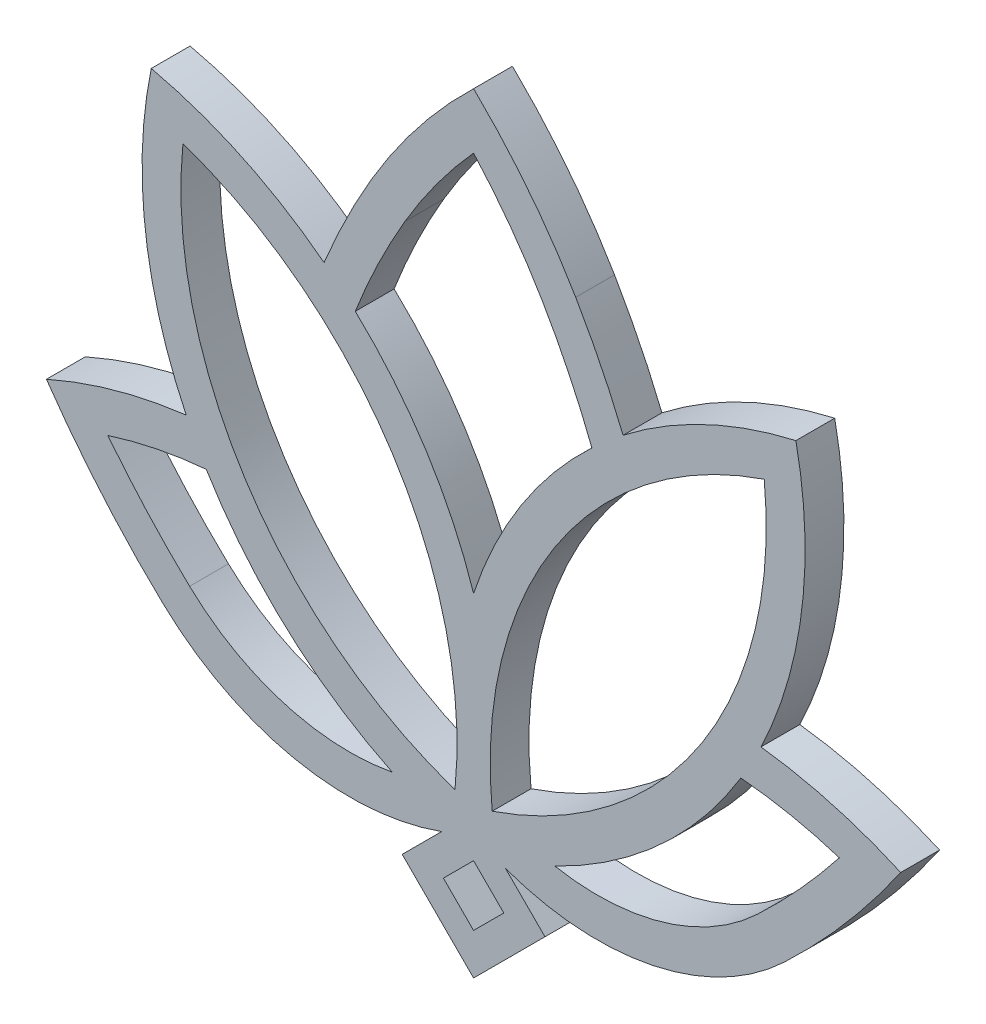
from build123d import *

# Parameters (mm, degrees)
BOSS_EXTRUDE1_DEPTH = 1


with BuildPart() as part:
    # Sketch1 → Boss-Extrude1 (new body)
    with BuildSketch(Plane.XY):
        with BuildLine():
            Line((0, 0), (1.838477631, 1.838477631))
            Line((1.838477631, 1.838477631), (0.823678808, 2.853276454))
            ThreePointArc((0.823678808, 2.853276454), (4.623918861, 2.588642918), (8, 4.353276454))
            ThreePointArc((8, 4.353276454), (9.591924549, 6.024483983), (11, 7.853276454))
            ThreePointArc((11, 7.853276454), (9.237519313, 8.488345979), (7.4, 8.853276454))
            ThreePointArc((7.4, 8.853276454), (8.450856423, 12.419917717), (8.3, 16.135085474))
            ThreePointArc((8.3, 16.135085474), (5.960145608, 15.324834522), (3.85, 14.029183838))
            ThreePointArc((3.85, 14.029183838), (3.284007759, 15.28410345), (2.63, 16.495484604))
            ThreePointArc((2.63, 16.495484604), (1.429185762, 18.254368816), (0, 19.833310412))
            ThreePointArc((0, 19.833310412), (-1.429185762, 18.254368816), (-2.63, 16.495484604))
            ThreePointArc((-2.63, 16.495484604), (-3.284007759, 15.28410345), (-3.85, 14.029183838))
            ThreePointArc((-3.85, 14.029183838), (-5.960145608, 15.324834522), (-8.3, 16.135085474))
            ThreePointArc((-8.3, 16.135085474), (-8.450856423, 12.419917717), (-7.4, 8.853276454))
            ThreePointArc((-7.4, 8.853276454), (-9.237519313, 8.488345979), (-11, 7.853276454))
            ThreePointArc((-11, 7.853276454), (-9.591924549, 6.024483983), (-8, 4.353276454))
            ThreePointArc((-8, 4.353276454), (-4.623918861, 2.588642918), (-0.823678808, 2.853276454))
            Line((-0.823678808, 2.853276454), (-1.838477631, 1.838477631))
            Line((-1.838477631, 1.838477631), (0, 0))
        make_face()
        Polygon((0, 1.060660172), (0.777817459, 1.838477631), (0, 2.61629509), (-0.777817459, 1.838477631), align=None, mode=Mode.SUBTRACT)
        with BuildLine():
            ThreePointArc((1.767555689, 15.989332639), (2.460089794, 14.692656758), (3.046312622, 13.344578636))
            ThreePointArc((3.046312622, 13.344578636), (1.223262024, 11.152840308), (0, 8.577794598))
            ThreePointArc((0, 8.577794598), (-1.223262024, 11.152840308), (-3.046312622, 13.344578636))
            ThreePointArc((-3.046312622, 13.344578636), (-2.460089794, 14.692656758), (-1.767555689, 15.989332639))
            ThreePointArc((-1.767555689, 15.989332639), (-0.945525016, 17.238680092), (0, 18.397380194))
            ThreePointArc((0, 18.397380194), (0.945525016, 17.238680092), (1.767555689, 15.989332639))
        make_face(mode=Mode.SUBTRACT)
        with BuildLine():
            ThreePointArc((7.484522548, 14.86555012), (2.078927518, 10.634692843), (0.478972095, 3.959308692))
            ThreePointArc((0.478972095, 3.959308692), (5.884567125, 8.190165969), (7.484522548, 14.86555012))
        make_face(mode=Mode.SUBTRACT)
        with BuildLine():
            ThreePointArc((2.091646058, 3.542273843), (4.886787797, 3.684978553), (7.313103604, 5.080031806))
            ThreePointArc((7.313103604, 5.080031806), (8.408951023, 6.195914234), (9.418710619, 7.390259542))
            ThreePointArc((9.418710619, 7.390259542), (8.165419306, 7.717459739), (6.883314947, 7.901870952))
            ThreePointArc((6.883314947, 7.901870952), (4.803155716, 5.375111185), (2.091646058, 3.542273843))
        make_face(mode=Mode.SUBTRACT)
        with BuildLine():
            ThreePointArc((-6.883314947, 7.901870952), (-8.165419306, 7.717459739), (-9.418710619, 7.390259542))
            ThreePointArc((-9.418710619, 7.390259542), (-8.408951023, 6.195914234), (-7.313103604, 5.080031806))
            ThreePointArc((-7.313103604, 5.080031806), (-4.886787797, 3.684978553), (-2.091646058, 3.542273843))
            ThreePointArc((-2.091646058, 3.542273843), (-4.803155716, 5.375111185), (-6.883314947, 7.901870952))
        make_face(mode=Mode.SUBTRACT)
        with BuildLine():
            ThreePointArc((-7.484522548, 14.86555012), (-5.884567125, 8.190165969), (-0.478972095, 3.959308692))
            ThreePointArc((-0.478972095, 3.959308692), (-2.078927518, 10.634692843), (-7.484522548, 14.86555012))
        make_face(mode=Mode.SUBTRACT)
    extrude(amount=BOSS_EXTRUDE1_DEPTH)


solid = part.part
